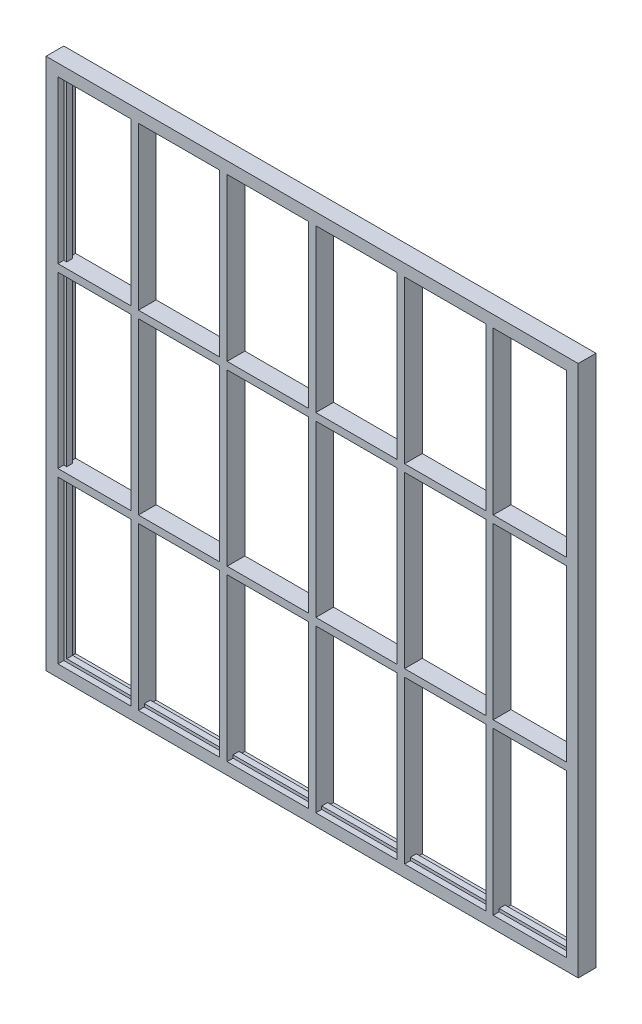
from build123d import *

# Parameters (mm, degrees)
EXTRUDE_1_DEPTH        = 900
EXTRUDE_1_2_DEPTH      = 900
EXTRUDE_2_DEPTH        = 1720
EXTRUDE_2_2_DEPTH      = 1720
SKETCH_4_W             = 50
SKETCH_4_H             = 60
CUT_EXTRUDE_1_DEPTH    = 10
SKETCH_5_W             = 50
SKETCH_5_H             = 60
CUT_EXTRUDE_2_DEPTH    = 10
SKETCH_6_W             = 60
SKETCH_6_H             = 25
EXTRUDE_3_DEPTH        = 1720
PATTERN_LINEAR_1_COUNT = 2
PATTERN_LINEAR_1_PITCH = 600
SKETCH_7_W             = 25
SKETCH_7_H             = 60
EXTRUDE_4_DEPTH        = 1729
PATTERN_LINEAR_2_COUNT = 5
PATTERN_LINEAR_2_PITCH = 300


with BuildPart() as part:
    # 草图1 → 凸台-拉伸1 (new, symmetric)
    with BuildSketch(Plane(origin=(0, 0, 0), x_dir=(0, 0, -1), z_dir=(1, 0, 0))):
        Polygon((30, 0), (-30, 0), (-30, 40), (-10, 40), (-10, 50), (10, 50), (10, 40), (30, 40), align=None)
    extrude(amount=EXTRUDE_1_DEPTH, both=True)

    # 草图5 → 切除-拉伸2 (cut)
    with BuildSketch(Plane(origin=(0, 40, 0), x_dir=(1, 0, 0), z_dir=(0, 1, 0))):
        with Locations((-875, 0)):
            Rectangle(SKETCH_5_W, SKETCH_5_H)
        with Locations((875, 0)):
            Rectangle(SKETCH_5_W, SKETCH_5_H)
    extrude(amount=CUT_EXTRUDE_2_DEPTH, mode=Mode.SUBTRACT)



with BuildPart() as body_2:
    # 草图1 → Extrude 1 2 (new, symmetric)
    with BuildSketch(Plane(origin=(0, 0, 0), x_dir=(0, 0, -1), z_dir=(1, 0, 0))):
        Polygon((30, 1800), (30, 1760), (10, 1760), (10, 1750), (-10, 1750), (-10, 1760), (-30, 1760), (-30, 1800), align=None)
    extrude(amount=EXTRUDE_1_2_DEPTH, both=True)

    # 草图4 → 切除-拉伸1 (cut)
    with BuildSketch(Plane.XZ.offset(-1760)):
        with Locations((-875, 0)):
            Rectangle(SKETCH_4_W, SKETCH_4_H)
        with Locations((875, 0)):
            Rectangle(SKETCH_4_W, SKETCH_4_H)
    extrude(amount=CUT_EXTRUDE_1_DEPTH, mode=Mode.SUBTRACT)


with BuildPart() as body_3:
    # 草图3 → 凸台-拉伸2 (new body)
    with BuildSketch(Plane.XZ.offset(-1760)):
        Polygon((-900, -30), (-900, 30), (-860, 30), (-860, 10), (-850, 10), (-850, -10), (-860, -10), (-860, -30), align=None)
    extrude(amount=EXTRUDE_2_DEPTH)



with BuildPart() as body_4:
    # 草图3 → Extrude 2 2 (new body)
    with BuildSketch(Plane.XZ.offset(-1760)):
        Polygon((860, -30), (900, -30), (900, 30), (860, 30), (860, 10), (850, 10), (850, -10), (860, -10), align=None)
    extrude(amount=EXTRUDE_2_2_DEPTH)


with BuildPart() as body_3_1:
    add(body_3.part)

    add(body_4.part)  # 凸台-拉伸3 merges body 4
    # 草图6 → 凸台-拉伸3 (add)
    with BuildSketch(Plane.ZY.offset(-860)):
        with Locations((0, 1200)):
            Rectangle(SKETCH_6_W, SKETCH_6_H)
    extrude_3 = extrude(amount=EXTRUDE_3_DEPTH)

    # 阵列(线性)1: 凸台-拉伸3 ×2
    with Locations(*[(0, -i * PATTERN_LINEAR_1_PITCH, 0) for i in range(1, PATTERN_LINEAR_1_COUNT)]):
        add(extrude_3)


with BuildPart() as part_1:
    add(part.part)

    add(body_2.part)  # 凸台-拉伸4 merges body 2

    add(body_3_1.part)  # 凸台-拉伸4 merges body 3
    # 草图7 → 凸台-拉伸4 (add)
    with BuildSketch(Plane.XZ.offset(-1760)):
        with Locations((-600, 0)):
            Rectangle(SKETCH_7_W, SKETCH_7_H)
    extrude_4 = extrude(amount=EXTRUDE_4_DEPTH)

    # 阵列(线性)2: 凸台-拉伸4 ×5
    with Locations(*[(i * PATTERN_LINEAR_2_PITCH, 0, 0) for i in range(1, PATTERN_LINEAR_2_COUNT)]):
        add(extrude_4)


solid = part_1.part
